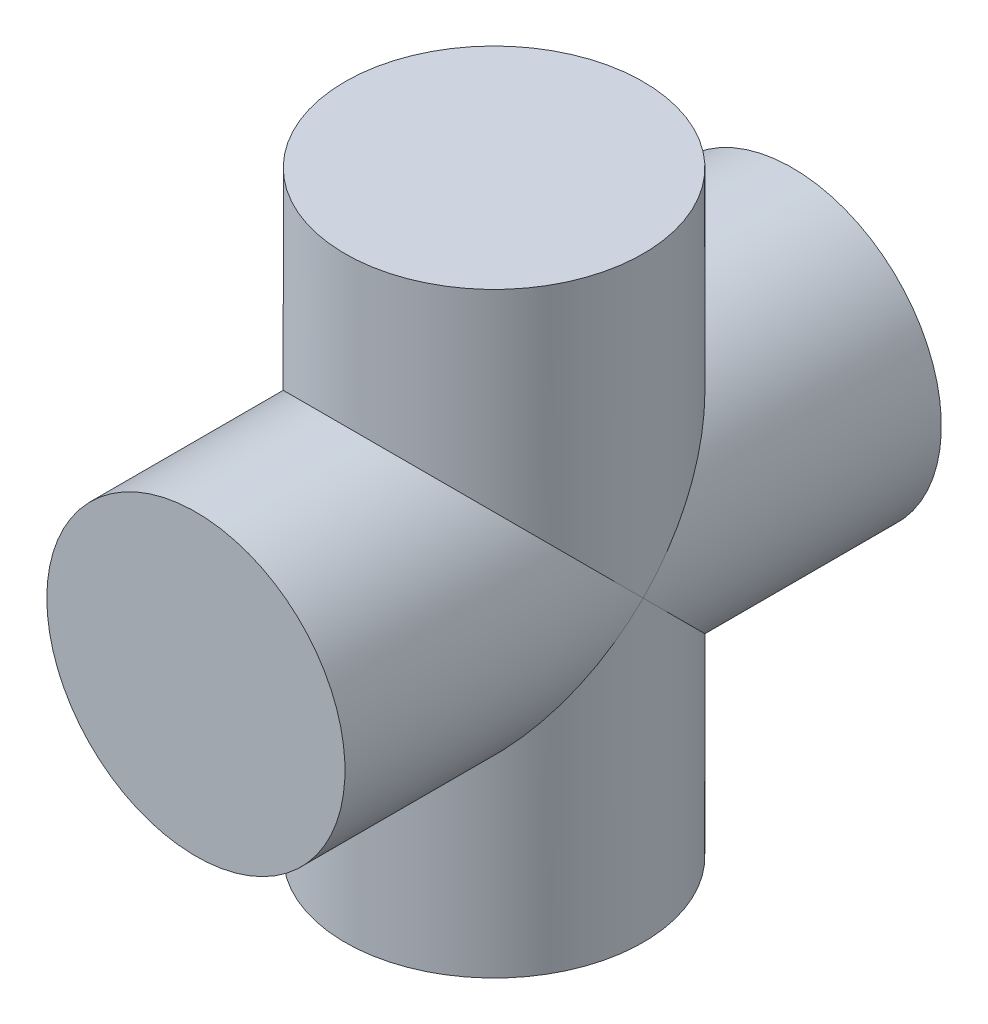
from build123d import *

# Parameters (mm, degrees)
SZKIC1_W = 10
SZKIC1_H = 40
SZKIC2_W = 10
SZKIC2_H = 40


with BuildPart() as part:
    # Szkic1 → Obrót1 (revolve)
    with BuildSketch(Plane.XY):
        with Locations((-5, 0)):
            Rectangle(SZKIC1_W, SZKIC1_H)
    revolve(axis=Axis((0, 20, 0), (0, -1, 0)))

    # Szkic2 → Obrót2 (revolve)
    with BuildSketch(Plane(origin=(0, 0, 0), x_dir=(1, 0, 0), z_dir=(0, 1, 0))):
        with Locations((-5, 0)):
            Rectangle(SZKIC2_W, SZKIC2_H)
    revolve(axis=Axis((0, 0, -20), (0, 0, 1)))


solid = part.part
